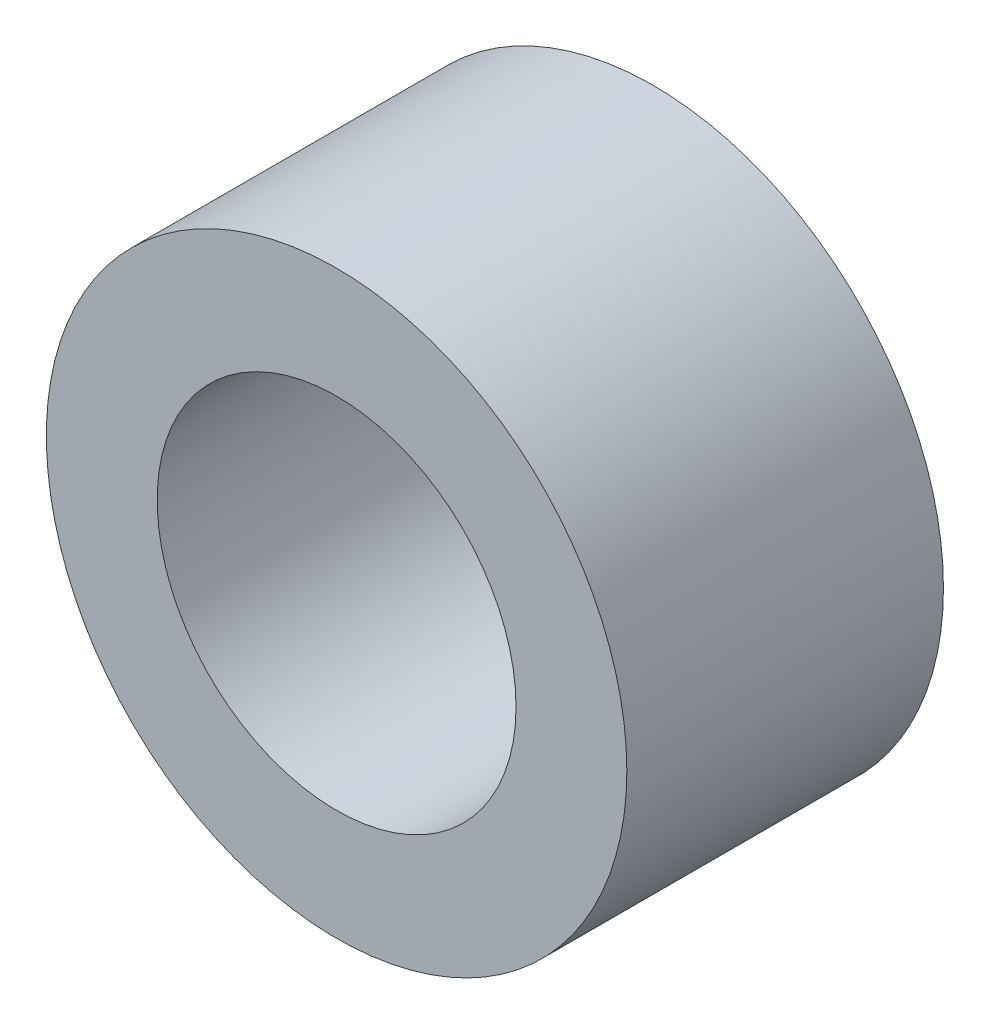
from build123d import *

# Parameters (mm, degrees)
ESQUISSE1_R        = 5.5
ESQUISSE1_R_2      = 3.4
BOSS_EXTRU_1_DEPTH = 6


with BuildPart() as part:
    # Esquisse1 → Boss.-Extru.1 (new body)
    with BuildSketch(Plane.XY):
        Circle(ESQUISSE1_R)
        Circle(ESQUISSE1_R_2, mode=Mode.SUBTRACT)
    extrude(amount=BOSS_EXTRU_1_DEPTH)


solid = part.part
